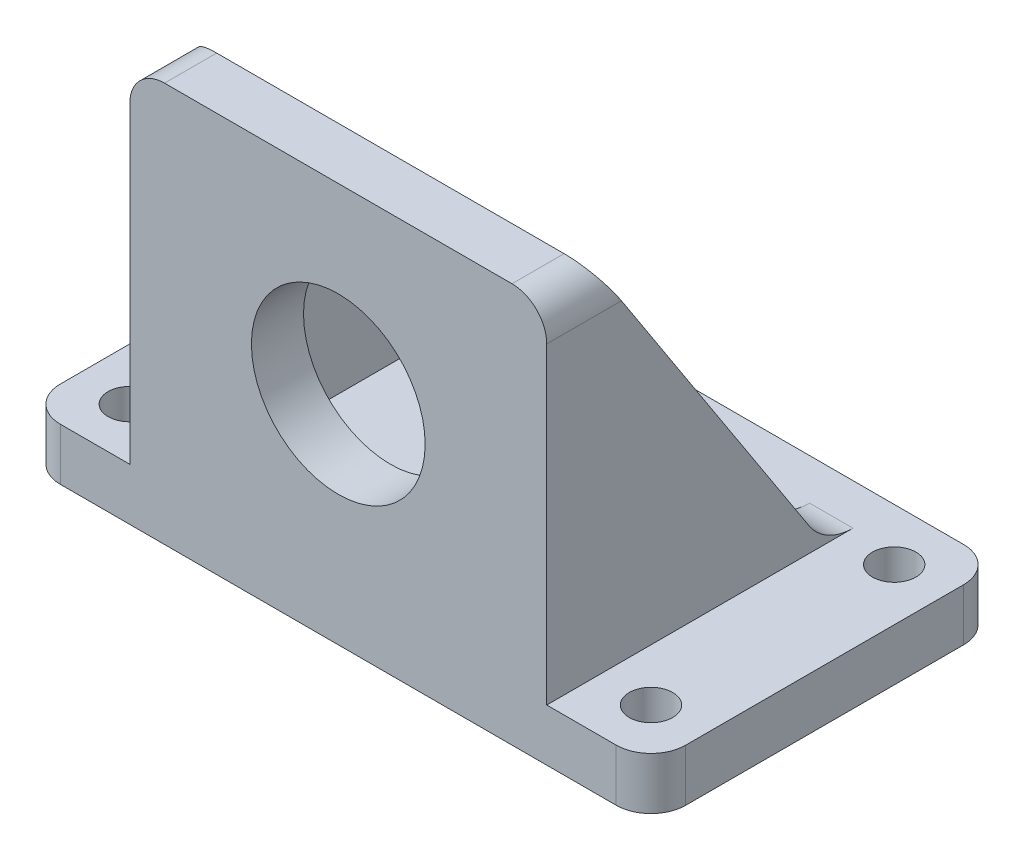
from build123d import *

# Parameters (mm, degrees)
SKETCH_1_W          = 36
SKETCH_1_H          = 20
EXTRUDE_1_DEPTH     = 3
SKETCH_6_R          = 1.25
CUT_EXTRUDE_3_DEPTH = 42.291645644
EXTRUDE_2_DEPTH     = 20
CUT_EXTRUDE_1_REACH = 49.17
SKETCH_3_R          = 5
CUT_EXTRUDE_2_DEPTH = 43.766809561
FILLET_1_R          = 2
FILLET_3_R          = 3
FILLET_4_R          = 2


with BuildPart() as part:
    # 草图1 → 凸台-拉伸1 (new body)
    with BuildSketch(Plane(origin=(0, 0, 0), x_dir=(1, 0, 0), z_dir=(0, 1, 0))):
        with Locations((18, 10)):
            Rectangle(SKETCH_1_W, SKETCH_1_H)
    extrude(amount=EXTRUDE_1_DEPTH)

    # 草图6 → 切除-拉伸3 (cut, through all)
    with BuildSketch(Plane(origin=(0, 3, 0), x_dir=(1, 0, 0), z_dir=(0, 1, 0))):
        with Locations(Location((3, 3, 0), (0, 0, 270))):
            Circle(SKETCH_6_R)
        with Locations(Location((3, 17, 0), (0, 0, 270))):
            Circle(SKETCH_6_R)
        with Locations(Location((33, 17, 0), (0, 0, 270))):
            Circle(SKETCH_6_R)
        with Locations(Location((33, 3, 0), (0, 0, 270))):
            Circle(SKETCH_6_R)
    extrude(amount=-CUT_EXTRUDE_3_DEPTH, mode=Mode.SUBTRACT)

    # 草图2 → 凸台-拉伸2 (add)
    with BuildSketch(Plane(origin=(0, 3, 0), x_dir=(1, 0, 0), z_dir=(0, 1, 0))):
        Polygon((6, 0), (30, 0), (30, 16), (27.5, 16), (27.5, 3), (8.5, 3), (8.5, 16), (6, 16), align=None)
    extrude(amount=EXTRUDE_2_DEPTH)

    # 草图3 → 切除-拉伸1 (cut, up to next)
    with BuildSketch(Plane.XY, mode=Mode.PRIVATE) as cut_extrude_1_sk1:
        with Locations((18, 12.5)):
            Circle(SKETCH_3_R)
    cut_extrude_1_tool1 = extrude(cut_extrude_1_sk1.sketch, amount=-CUT_EXTRUDE_1_REACH, mode=Mode.PRIVATE) & part.part
    add(cut_extrude_1_tool1.solids().sort_by_distance((18, 12.5, 0))[0], mode=Mode.SUBTRACT)

    # 草图4 → 切除-拉伸2 (cut, through all)
    with BuildSketch(Plane(origin=(30, 0, 0), x_dir=(0, 0, -1), z_dir=(1, 0, 0))):
        Polygon((3, 23), (16, 23), (16, 3), align=None)
    extrude(amount=-CUT_EXTRUDE_2_DEPTH, mode=Mode.SUBTRACT)

    # 圆角1
    fillet_1_edges = [part.edges().sort_by_distance(p)[0] for p in [
        (0, 1.5, -20),
        (36, 1.5, -20),
        (36, 1.5, 0),
        (0, 1.5, 0),
    ]]
    fillet(fillet_1_edges, radius=FILLET_1_R)

    # 圆角3
    fillet_3_edges = [part.edges().sort_by_distance(p)[0] for p in [
        (28.75, 3, -16),
        (7.25, 3, -16),
    ]]
    fillet(fillet_3_edges, radius=FILLET_3_R)

    # 圆角4
    fillet_4_edges = [part.edges().sort_by_distance(p)[0] for p in [
        (30, 23, -1.5),
        (6, 23, -1.5),
    ]]
    fillet(fillet_4_edges, radius=FILLET_4_R)


solid = part.part
